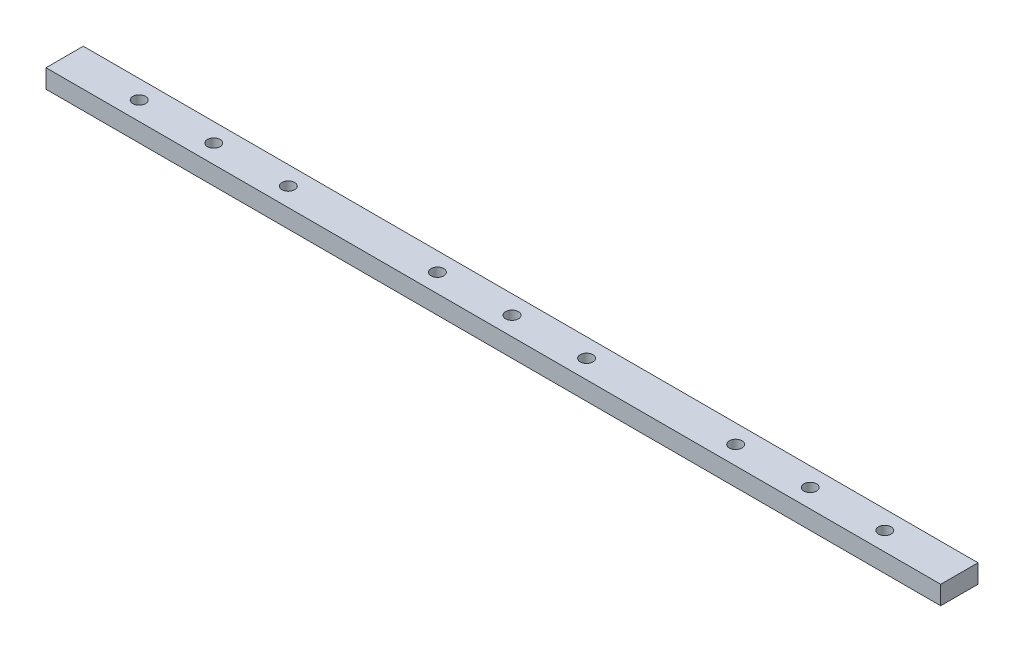
from build123d import *

# Parameters (mm, degrees)
SKETCH_1_W      = 240
SKETCH_1_H      = 10
SKETCH_1_R      = 1.7
EXTRUDE_1_DEPTH = 5


with BuildPart() as part:
    # 草图1 → 凸台-拉伸1 (new body)
    with BuildSketch(Plane(origin=(0, 0, 0), x_dir=(1, 0, 0), z_dir=(0, 1, 0))):
        with Locations((120, 5)):
            Rectangle(SKETCH_1_W, SKETCH_1_H)
        with Locations(Location((20, 5, 0), (0, 0, 270))):
            Circle(SKETCH_1_R, mode=Mode.SUBTRACT)
        with Locations(Location((40, 5, 0), (0, 0, 270))):
            Circle(SKETCH_1_R, mode=Mode.SUBTRACT)
        with Locations(Location((120, 5, 0), (0, 0, 270))):
            Circle(SKETCH_1_R, mode=Mode.SUBTRACT)
        with Locations(Location((60, 5, 0), (0, 0, 270))):
            Circle(SKETCH_1_R, mode=Mode.SUBTRACT)
        with Locations(Location((100, 5, 0), (0, 0, 270))):
            Circle(SKETCH_1_R, mode=Mode.SUBTRACT)
        with Locations(Location((140, 5, 0), (0, 0, 90))):
            Circle(SKETCH_1_R, mode=Mode.SUBTRACT)
        with Locations(Location((180, 5, 0), (0, 0, 90))):
            Circle(SKETCH_1_R, mode=Mode.SUBTRACT)
        with Locations(Location((200, 5, 0), (0, 0, 90))):
            Circle(SKETCH_1_R, mode=Mode.SUBTRACT)
        with Locations(Location((220, 5, 0), (0, 0, 90))):
            Circle(SKETCH_1_R, mode=Mode.SUBTRACT)
    extrude(amount=EXTRUDE_1_DEPTH)


solid = part.part
